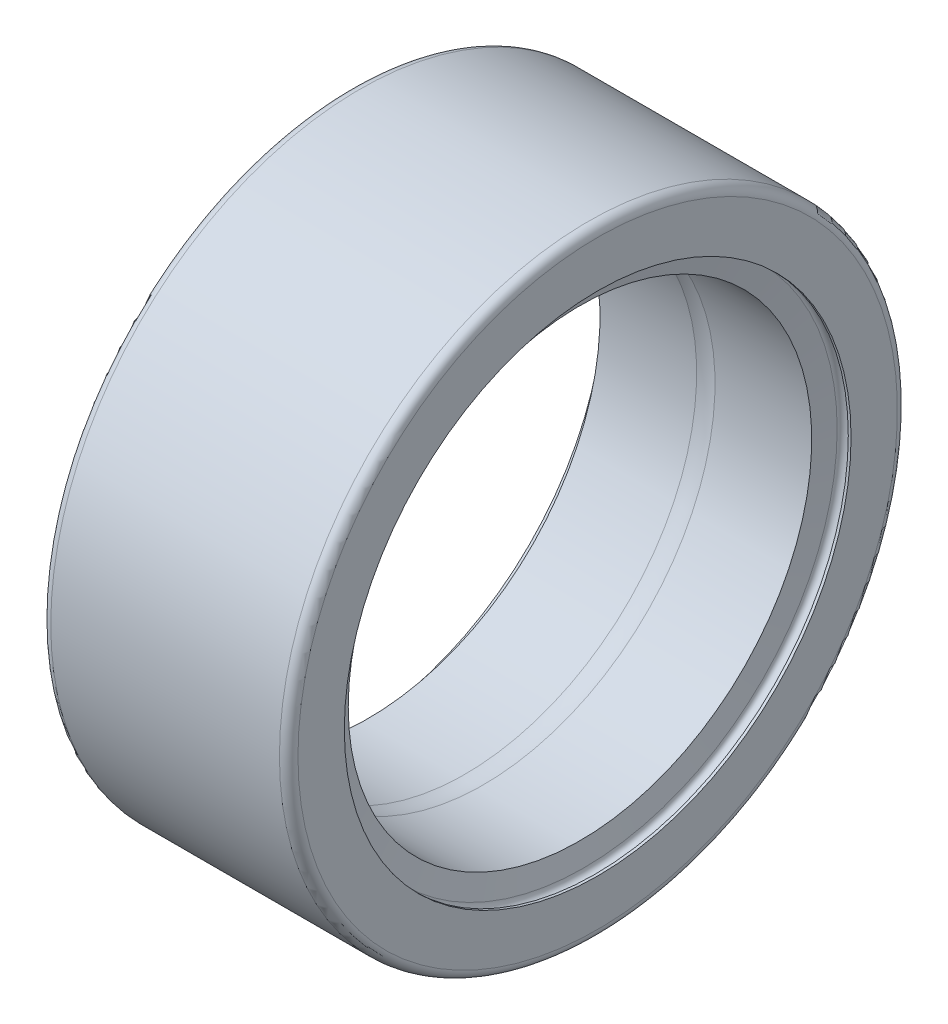
from build123d import *


with BuildPart() as part:
    # Sketch1 → Revolve1 (revolve)
    with BuildSketch(Plane.XY, mode=Mode.PRIVATE) as revolve1_sk:
        with BuildLine():
            Line((0, 4.1), (0.045, 4.1))
            ThreePointArc((0.045, 4.1), (0.135, 4.19), (0.225, 4.1))
            Line((0.225, 4.1), (0.286714443, 3.75))
            Line((0.286714443, 3.75), (1.851554724, 3.75))
            ThreePointArc((1.851554724, 3.75), (2, 3.764), (2.148445276, 3.75))
            Line((2.148445276, 3.75), (3.713285557, 3.75))
            Line((3.713285557, 3.75), (3.775, 4.1))
            ThreePointArc((3.775, 4.1), (3.865, 4.190000005), (3.955, 4.1))
            Line((3.955, 4.1), (4, 4.1))
            Line((4, 4.1), (4, 4.85))
            ThreePointArc((4, 4.85), (3.956066017, 4.956066017), (3.85, 5))
            Line((3.85, 5), (0.15, 5))
            ThreePointArc((0.15, 5), (0.043933983, 4.956066017), (0, 4.85))
            Line((0, 4.85), (0, 4.1))
        make_face()
    revolve(revolve1_sk.sketch.rotate(Axis((50, 0, 0), (-1, 0, 0)), 270), axis=Axis((50, 0, 0), (-1, 0, 0)))


solid = part.part
